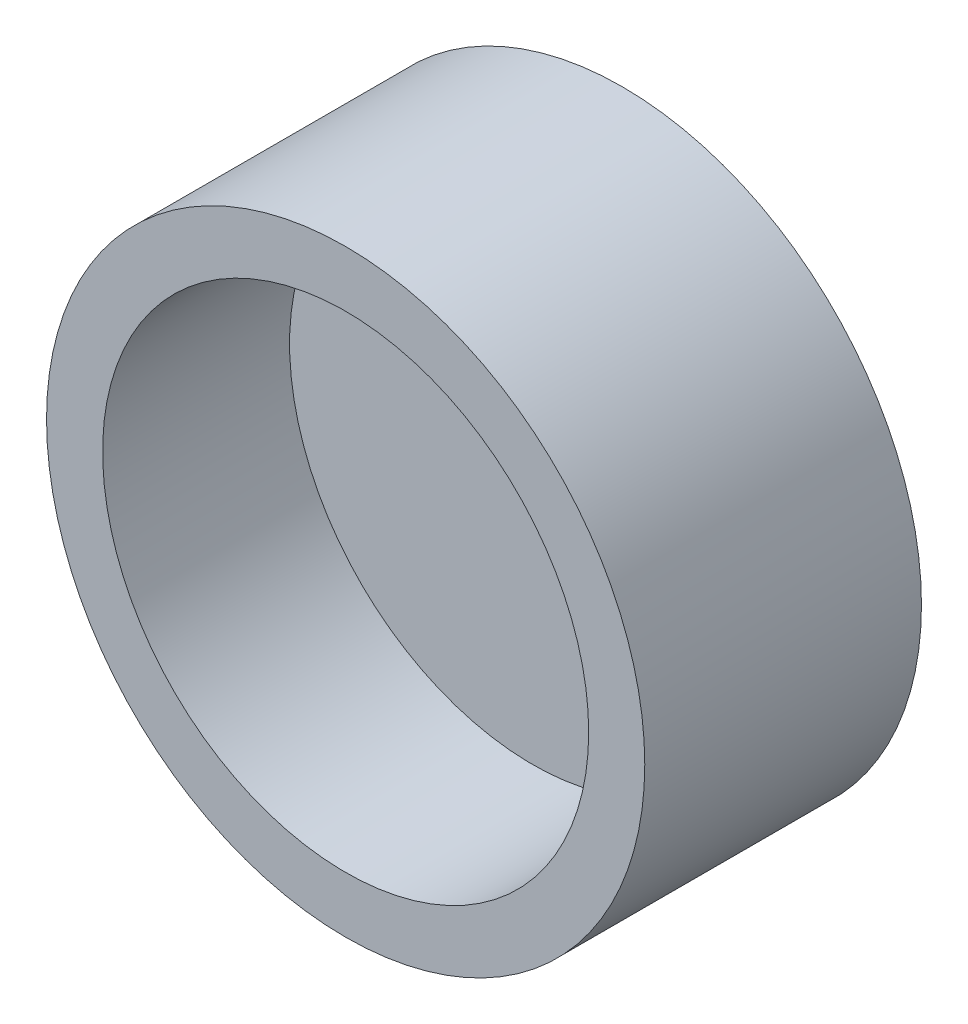
from build123d import *

# Parameters (mm, degrees)
SKETCH_1_R          = 8
EXTRUDE_1_DEPTH     = 7.4
SKETCH_2_R          = 6.5
CUT_EXTRUDE_1_DEPTH = 5


with BuildPart() as part:
    # 草图1 → 凸台-拉伸1 (new body)
    with BuildSketch(Plane.XY):
        Circle(SKETCH_1_R)
    extrude(amount=EXTRUDE_1_DEPTH)

    # 草图2 → 切除-拉伸1 (cut)
    with BuildSketch(Plane.XY.offset(7.4)):
        Circle(SKETCH_2_R)
    extrude(amount=-CUT_EXTRUDE_1_DEPTH, mode=Mode.SUBTRACT)


solid = part.part
